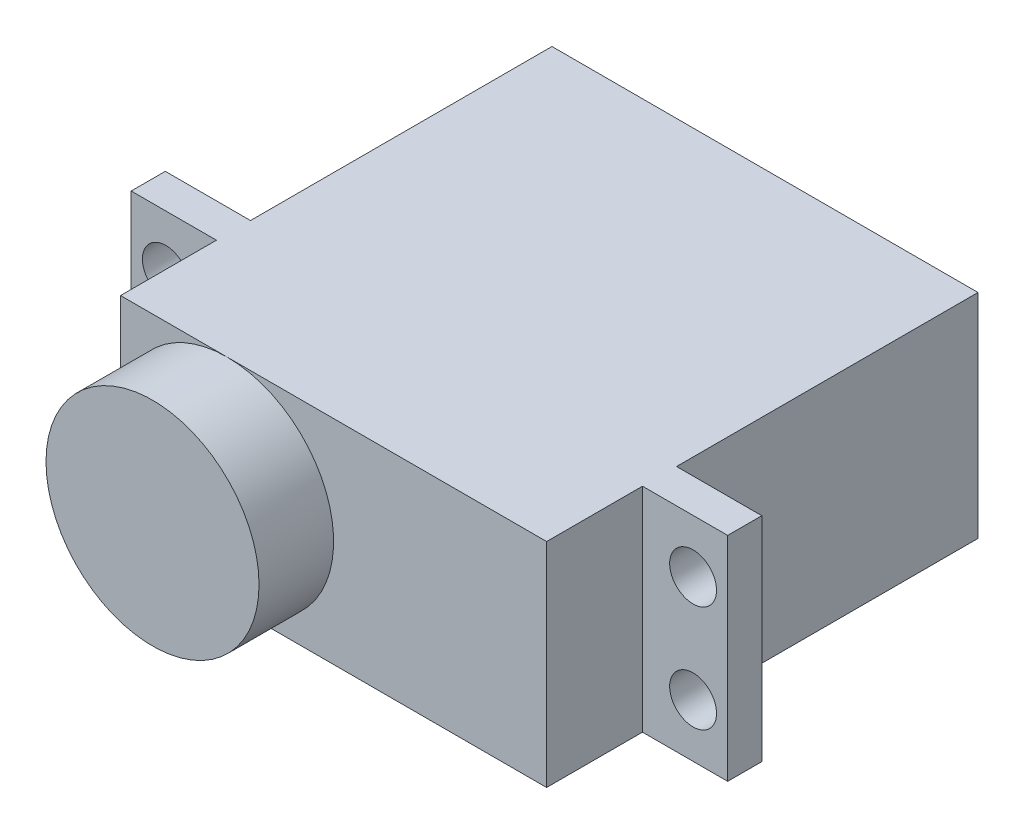
from build123d import *

# Parameters (mm, degrees)
SKETCH1_W           = 40
SKETCH1_H           = 20
BOSS_EXTRUDE1_DEPTH = 40.5
SKETCH2_R           = 10
BOSS_EXTRUDE2_DEPTH = 7
SKETCH3_W           = 3.2
SKETCH3_H           = 20
BOSS_EXTRUDE3_DEPTH = 8
SKETCH4_W           = 3.2
SKETCH4_H           = 20
BOSS_EXTRUDE4_DEPTH = 8
SKETCH6_R           = 2.2
CUT_EXTRUDE1_DEPTH  = 8
SKETCH8_R           = 2.2
CUT_EXTRUDE3_DEPTH  = 8


with BuildPart() as part:
    # Sketch1 → Boss-Extrude1 (new body)
    with BuildSketch(Plane.XY):
        Rectangle(SKETCH1_W, SKETCH1_H)
    extrude(amount=-BOSS_EXTRUDE1_DEPTH)

    # Sketch2 → Boss-Extrude2 (add)
    with BuildSketch(Plane.XY):
        with Locations(Location((-10, 0, 0), (0, 0, 180))):
            Circle(SKETCH2_R)
    extrude(amount=BOSS_EXTRUDE2_DEPTH)

    # Sketch3 → Boss-Extrude3 (add)
    with BuildSketch(Plane.ZY.offset(20)):
        with Locations((-10.6, 0)):
            Rectangle(SKETCH3_W, SKETCH3_H)
    extrude(amount=BOSS_EXTRUDE3_DEPTH)

    # Sketch4 → Boss-Extrude4 (add)
    with BuildSketch(Plane(origin=(20, 0, 0), x_dir=(0, 0, -1), z_dir=(1, 0, 0))):
        with Locations((10.6, 0)):
            Rectangle(SKETCH4_W, SKETCH4_H)
    extrude(amount=BOSS_EXTRUDE4_DEPTH)

    # Sketch6 → Cut-Extrude1 (cut)
    with BuildSketch(Plane.XY.offset(-9)):
        with Locations((-24.75, 5)):
            Circle(SKETCH6_R)
        with Locations((-24.75, -5)):
            Circle(SKETCH6_R)
    extrude(amount=-CUT_EXTRUDE1_DEPTH, mode=Mode.SUBTRACT)

    # Sketch8 → Cut-Extrude3 (cut)
    with BuildSketch(Plane.XY.offset(-9)):
        with Locations((24.75, 5)):
            Circle(SKETCH8_R)
        with Locations((24.75, -5)):
            Circle(SKETCH8_R)
    extrude(amount=-CUT_EXTRUDE3_DEPTH, mode=Mode.SUBTRACT)


solid = part.part
